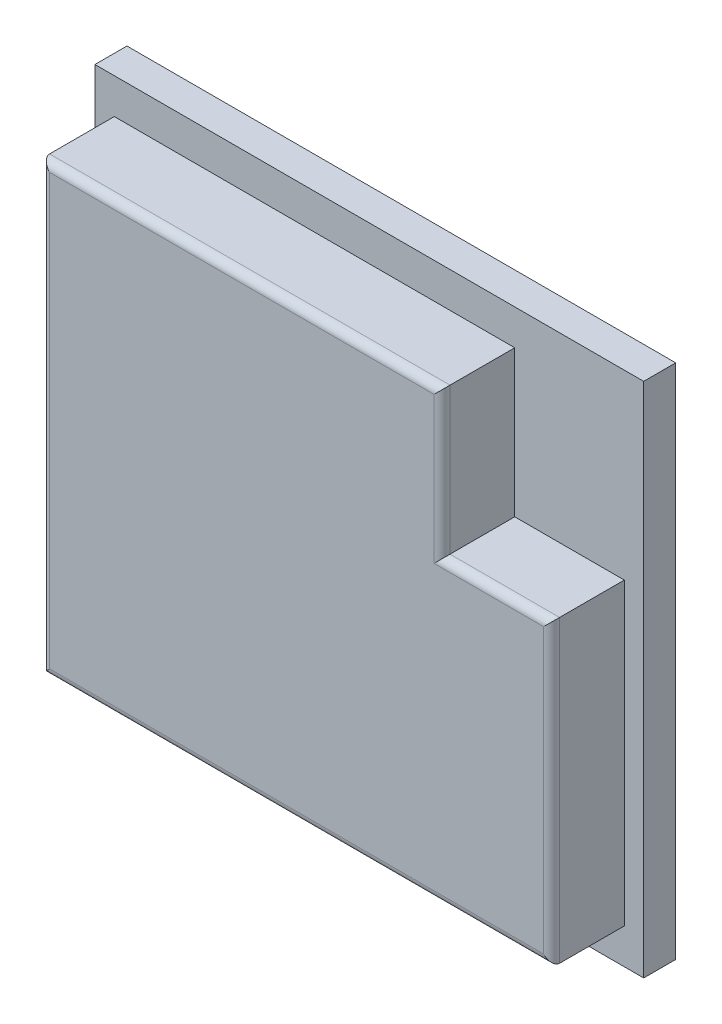
from build123d import *

# Parameters (mm, degrees)
SKETCH_1_W      = 17.13
SKETCH_1_H      = 16.13
EXTRUDE_1_DEPTH = 1
EXTRUDE_2_DEPTH = 2.27
FILLET_1_R      = 0.25


with BuildPart() as part:
    # Эскиз1 → Бобышка-Вытянуть1 (new body)
    with BuildSketch(Plane.XY):
        Rectangle(SKETCH_1_W, SKETCH_1_H)
    extrude(amount=EXTRUDE_1_DEPTH)

    # Эскиз2 → Бобышка-Вытянуть2 (add)
    with BuildSketch(Plane.XY.offset(1)):
        Polygon((4.54, 6.96), (4.54, 2.39), (7.96, 2.39), (7.96, -6.96), (-7.96, -6.96), (-7.96, 6.96), align=None)
    extrude(amount=EXTRUDE_2_DEPTH)

    # Скругление1
    fillet_1_edges = [part.edges().sort_by_distance(p)[0] for p in [
        (-7.96, 0, 3.27),
        (0, -6.96, 3.27),
        (7.96, -2.285, 3.27),
        (6.25, 2.39, 3.27),
        (4.54, 4.675, 3.27),
        (-1.71, 6.96, 3.27),
    ]]
    fillet(fillet_1_edges, radius=FILLET_1_R)


solid = part.part
